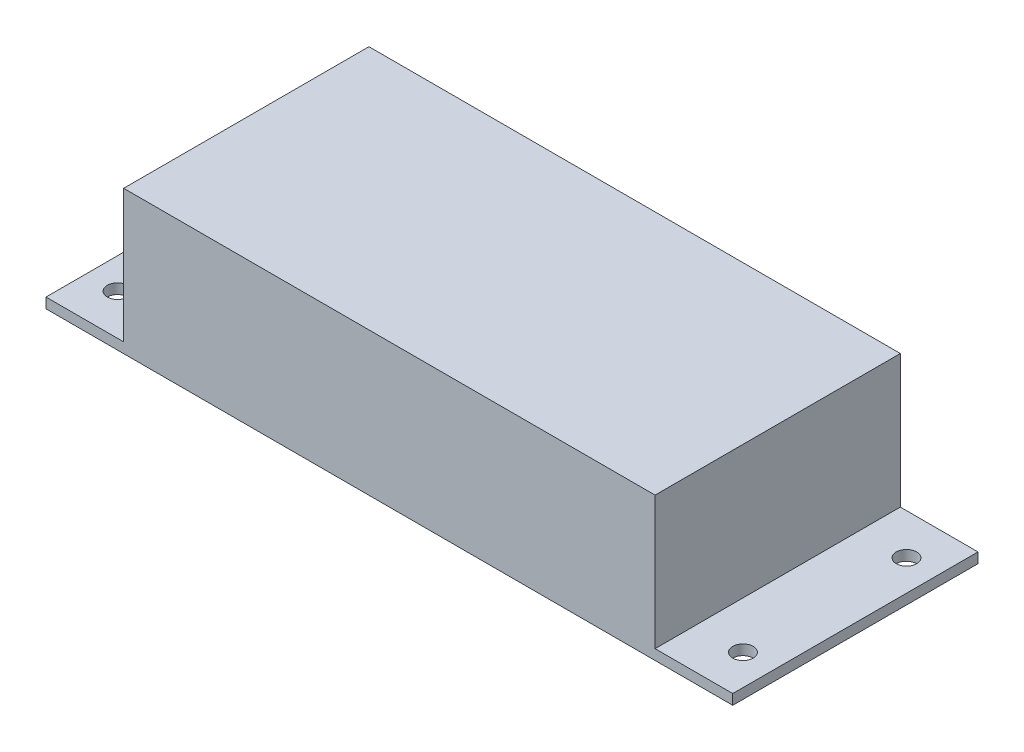
from build123d import *

# Parameters (mm, degrees)
SKETCH1_W           = 82.55
SKETCH1_H           = 38.1
BOSS_EXTRUDE1_DEPTH = 22.2504
SKETCH2_W           = 106.68
SKETCH2_H           = 38.1
SKETCH2_R           = 1.5875
BOSS_EXTRUDE2_DEPTH = 1.5875


with BuildPart() as part:
    # Sketch1 → Boss-Extrude1 (new body)
    with BuildSketch(Plane(origin=(0, 0, 0), x_dir=(1, 0, 0), z_dir=(0, 1, 0))):
        Rectangle(SKETCH1_W, SKETCH1_H)
    extrude(amount=BOSS_EXTRUDE1_DEPTH)

    # Sketch2 → Boss-Extrude2 (add)
    with BuildSketch(Plane(origin=(0, 0, 0), x_dir=(1, 0, 0), z_dir=(0, 1, 0))):
        Rectangle(SKETCH2_W, SKETCH2_H)
        with Locations(Location((-48.5775, 12.7, 0), (0, 0, 270))):
            Circle(SKETCH2_R, mode=Mode.SUBTRACT)
        with Locations(Location((48.5775, 12.7, 0), (0, 0, 90))):
            Circle(SKETCH2_R, mode=Mode.SUBTRACT)
        with Locations(Location((48.5775, -12.7, 0), (0, 0, 270))):
            Circle(SKETCH2_R, mode=Mode.SUBTRACT)
        with Locations(Location((-48.5775, -12.7, 0), (0, 0, 90))):
            Circle(SKETCH2_R, mode=Mode.SUBTRACT)
    extrude(amount=BOSS_EXTRUDE2_DEPTH)


solid = part.part
